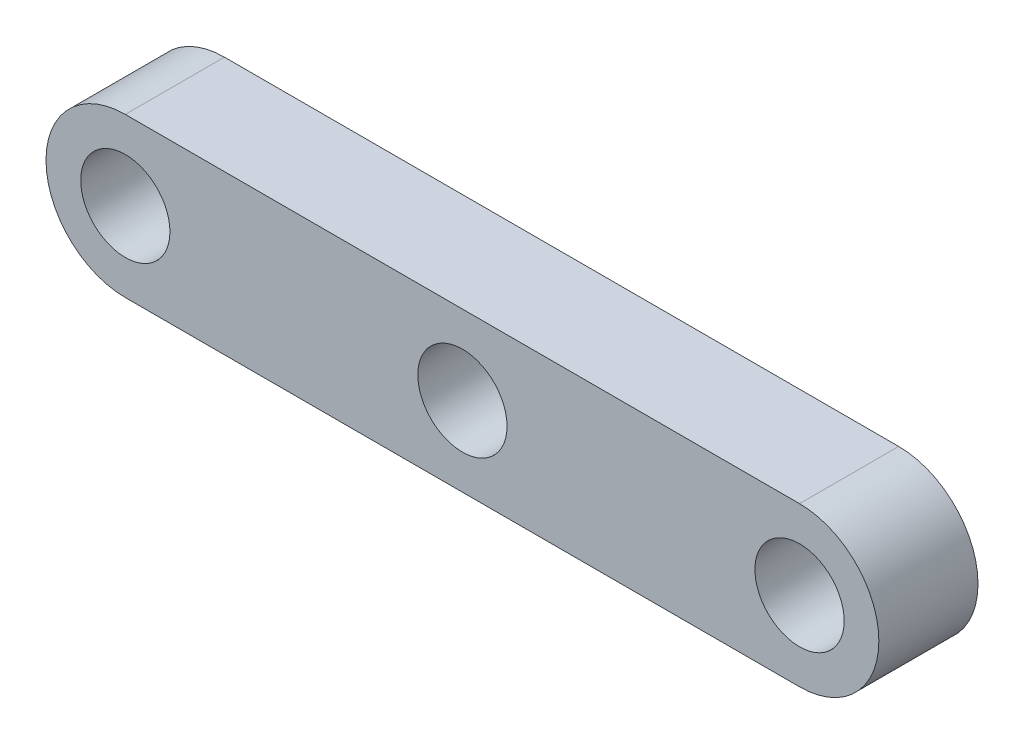
from build123d import *

# Parameters (mm, degrees)
SKETCH1_R           = 2.25
BOSS_EXTRUDE1_DEPTH = 5


with BuildPart() as part:
    # Sketch1 → Boss-Extrude1 (new body)
    with BuildSketch(Plane.XY):
        with BuildLine():
            Line((-17, 4), (17, 4))
            ThreePointArc((17, 4), (21, 0), (17, -4))
            Line((17, -4), (-17, -4))
            ThreePointArc((-17, -4), (-21, 0), (-17, 4))
        make_face()
        Circle(SKETCH1_R, mode=Mode.SUBTRACT)
        with Locations((-17, 0)):
            Circle(SKETCH1_R, mode=Mode.SUBTRACT)
        with Locations((17, 0)):
            Circle(SKETCH1_R, mode=Mode.SUBTRACT)
    extrude(amount=BOSS_EXTRUDE1_DEPTH)


solid = part.part
